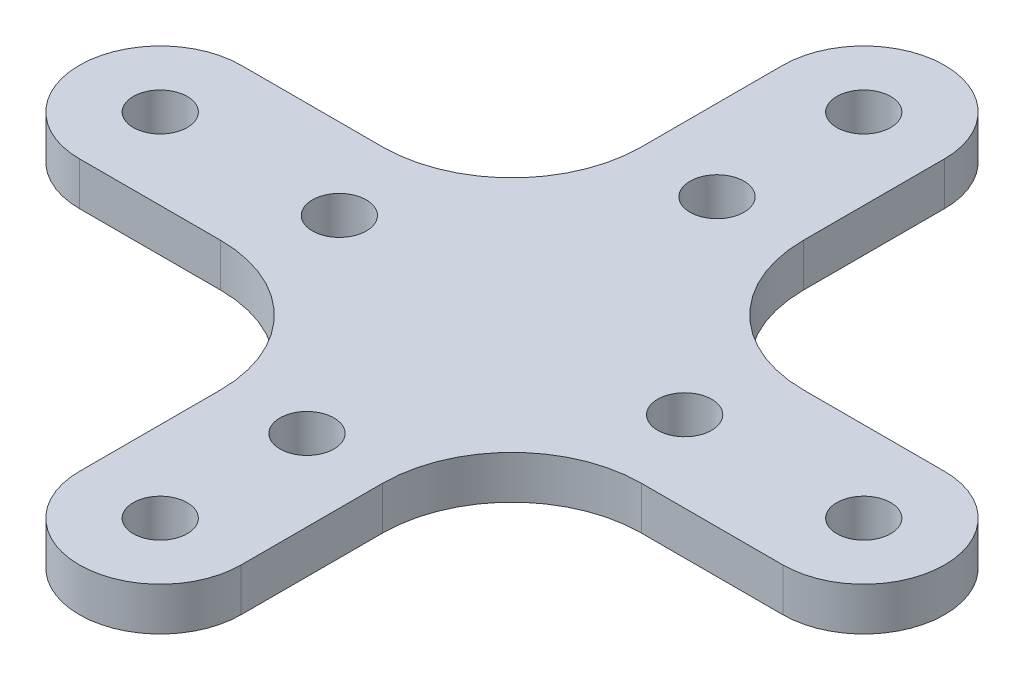
from build123d import *

# Parameters (mm, degrees)
SKETCH_1_R      = 1.25
EXTRUDE_1_DEPTH = 2


with BuildPart() as part:
    # 草圖1 → 填料-伸長1 (new body)
    with BuildSketch(Plane(origin=(0, 0, 0), x_dir=(1, 0, 0), z_dir=(0, 1, 0))):
        with BuildLine():
            Line((-3.75, 16.3), (-3.75, 9.75))
            ThreePointArc((-3.75, 9.75), (-5.507359313, 5.507359313), (-9.75, 3.75))
            Line((-9.75, 3.75), (-16.3, 3.75))
            ThreePointArc((-16.3, 3.75), (-20.05, 0), (-16.3, -3.75))
            Line((-16.3, -3.75), (-9.75, -3.75))
            ThreePointArc((-9.75, -3.75), (-5.507359313, -5.507359313), (-3.75, -9.75))
            Line((-3.75, -9.75), (-3.75, -16.3))
            ThreePointArc((-3.75, -16.3), (0, -20.05), (3.75, -16.3))
            Line((3.75, -16.3), (3.75, -9.75))
            ThreePointArc((3.75, -9.75), (5.507359313, -5.507359313), (9.75, -3.75))
            Line((9.75, -3.75), (16.3, -3.75))
            ThreePointArc((16.3, -3.75), (20.05, 0), (16.3, 3.75))
            Line((16.3, 3.75), (9.75, 3.75))
            ThreePointArc((9.75, 3.75), (5.507359313, 5.507359313), (3.75, 9.75))
            Line((3.75, 9.75), (3.75, 16.3))
            ThreePointArc((3.75, 16.3), (0, 20.05), (-3.75, 16.3))
        make_face()
        with Locations(Location((0, 16.3, 0), (0, 0, 270))):
            Circle(SKETCH_1_R, mode=Mode.SUBTRACT)
        with Locations(Location((-16.3, 0, 0), (0, 0, 270))):
            Circle(SKETCH_1_R, mode=Mode.SUBTRACT)
        with Locations(Location((0, -16.3, 0), (0, 0, 270))):
            Circle(SKETCH_1_R, mode=Mode.SUBTRACT)
        with Locations(Location((16.3, 0, 0), (0, 0, 270))):
            Circle(SKETCH_1_R, mode=Mode.SUBTRACT)
        with Locations(Location((0, 9.5, 0), (0, 0, 270))):
            Circle(SKETCH_1_R, mode=Mode.SUBTRACT)
        with Locations(Location((-8, 0, 0), (0, 0, 270))):
            Circle(SKETCH_1_R, mode=Mode.SUBTRACT)
        with Locations(Location((0, -9.5, 0), (0, 0, 270))):
            Circle(SKETCH_1_R, mode=Mode.SUBTRACT)
        with Locations(Location((8, 0, 0), (0, 0, 270))):
            Circle(SKETCH_1_R, mode=Mode.SUBTRACT)
    extrude(amount=EXTRUDE_1_DEPTH)


solid = part.part
